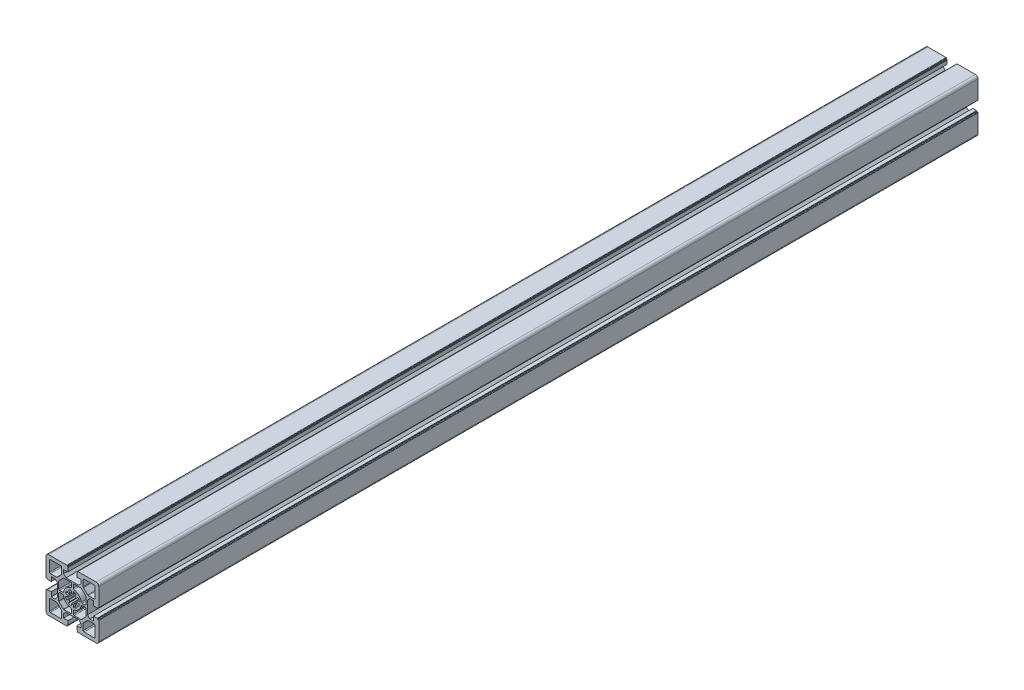
from build123d import *

# Parameters (mm, degrees)
BASE_EXTRUDE_DEPTH = 1000
ESCALA1_SCALE      = 0.5


with BuildPart() as part:
    # Sketch1 → Base-Extrude (new body)
    with BuildSketch(Plane.XY):
        with BuildLine():
            Line((7.24997588, 17.000014817), (-2.412e-05, 17.000014817))
            Line((-2.412e-05, 17.000014817), (-7.25002412, 17.000014817))
            Line((-7.25002412, 17.000014817), (-10.05002512, 19.800013819))
            Line((-10.05002512, 19.800013819), (-10.05002512, 24.000014819))
            Line((-10.05002512, 24.000014819), (-5.00002412, 24.000014819))
            Line((-5.00002412, 24.000014819), (-5.00002412, 28.20002069))
            ThreePointArc((-5.00002412, 28.20002069), (-5.08789044, 28.41214864), (-5.300018455, 28.500014819))
            Line((-5.300018455, 28.500014819), (-5.500021455, 28.500014819))
            ThreePointArc((-5.500021455, 28.500014819), (-5.712152769, 28.587882347), (-5.800020455, 28.800013596))
            Line((-5.800020455, 28.800013596), (-5.800020455, 29.500015192))
            ThreePointArc((-5.800020455, 29.500015192), (-5.946466955, 29.853568318), (-6.300020081, 30.000014817))
            Line((-6.300020081, 30.000014817), (-27.000022696, 30.000014817))
            ThreePointArc((-27.000022696, 30.000014817), (-29.121341455, 29.121335817), (-30.000020455, 27.000017059))
            Line((-30.000020455, 27.000017059), (-30.000020455, 6.300013444))
            ThreePointArc((-30.000020455, 6.300013444), (-29.853573955, 5.946460317), (-29.500020828, 5.800013817))
            Line((-29.500020828, 5.800013817), (-28.800019731, 5.800013817))
            ThreePointArc((-28.800019731, 5.800013817), (-28.587888208, 5.712146064), (-28.500020455, 5.500014542))
            Line((-28.500020455, 5.500014542), (-28.500020455, 5.300014093))
            ThreePointArc((-28.500020455, 5.300014093), (-28.412152701, 5.087882571), (-28.200021179, 5.000014817))
            Line((-28.200021179, 5.000014817), (-24.000020455, 5.000014817))
            Line((-24.000020455, 5.000014817), (-24.000020455, 10.050012866))
            Line((-24.000020455, 10.050012866), (-19.800019665, 10.050012866))
            Line((-19.800019665, 10.050012866), (-17.000019665, 7.250013866))
            Line((-17.000019665, 7.250013866), (-17.000019665, 4.3167e-05))
            Line((-17.000019665, 4.3167e-05), (-17.000019665, -7.249956831))
            Line((-17.000019665, -7.249956831), (-19.800019665, -10.049955831))
            Line((-19.800019665, -10.049955831), (-24.000020455, -10.049955831))
            Line((-24.000020455, -10.049955831), (-24.000020455, -4.999957783))
            Line((-24.000020455, -4.999957783), (-28.200021179, -4.999957783))
            ThreePointArc((-28.200021179, -4.999957783), (-28.412152701, -5.087825536), (-28.500020455, -5.299957058))
            Line((-28.500020455, -5.299957058), (-28.500020455, -5.499957507))
            ThreePointArc((-28.500020455, -5.499957507), (-28.587888208, -5.712089029), (-28.800019731, -5.799956783))
            Line((-28.800019731, -5.799956783), (-29.500020828, -5.799956783))
            ThreePointArc((-29.500020828, -5.799956783), (-29.853573955, -5.946403283), (-30.000020455, -6.299956409))
            Line((-30.000020455, -6.299956409), (-30.000020455, -26.999960024))
            ThreePointArc((-30.000020455, -26.999960024), (-29.121341455, -29.121278783), (-27.000022696, -29.999957783))
            Line((-27.000022696, -29.999957783), (-6.300020081, -29.999957783))
            ThreePointArc((-6.300020081, -29.999957783), (-5.946466955, -29.853511283), (-5.800020455, -29.499958157))
            Line((-5.800020455, -29.499958157), (-5.800020455, -28.799956561))
            ThreePointArc((-5.800020455, -28.799956561), (-5.712152769, -28.587825312), (-5.500021455, -28.499957784))
            Line((-5.500021455, -28.499957784), (-5.300018455, -28.499957784))
            ThreePointArc((-5.300018455, -28.499957784), (-5.08789044, -28.412091605), (-5.00002412, -28.199963655))
            Line((-5.00002412, -28.199963655), (-5.00002412, -23.999957784))
            Line((-5.00002412, -23.999957784), (-10.05002512, -23.999957784))
            Line((-10.05002512, -23.999957784), (-10.05002512, -19.799956784))
            Line((-10.05002512, -19.799956784), (-7.25002412, -16.999957783))
            Line((-7.25002412, -16.999957783), (-2.412e-05, -16.999957783))
            Line((-2.412e-05, -16.999957783), (7.24997588, -16.999957783))
            Line((7.24997588, -16.999957783), (10.04997688, -19.799956784))
            Line((10.04997688, -19.799956784), (10.04997688, -23.999957784))
            Line((10.04997688, -23.999957784), (4.99997588, -23.999957784))
            Line((4.99997588, -23.999957784), (4.99997588, -28.199963655))
            ThreePointArc((4.99997588, -28.199963655), (5.0878422, -28.412091605), (5.299970215, -28.499957784))
            Line((5.299970215, -28.499957784), (5.499973215, -28.499957784))
            ThreePointArc((5.499973215, -28.499957784), (5.71210453, -28.587825312), (5.799972216, -28.799956561))
            Line((5.799972216, -28.799956561), (5.799972216, -29.499958157))
            ThreePointArc((5.799972216, -29.499958157), (5.946418716, -29.853511283), (6.299971842, -29.999957783))
            Line((6.299971842, -29.999957783), (26.999974457, -29.999957783))
            ThreePointArc((26.999974457, -29.999957783), (29.121293215, -29.121278783), (29.999972215, -26.999960024))
            Line((29.999972215, -26.999960024), (29.999972215, -6.299956409))
            ThreePointArc((29.999972215, -6.299956409), (29.853525715, -5.946403283), (29.499972589, -5.799956783))
            Line((29.499972589, -5.799956783), (28.799971491, -5.799956783))
            ThreePointArc((28.799971491, -5.799956783), (28.587839969, -5.712089029), (28.499972215, -5.499957507))
            Line((28.499972215, -5.499957507), (28.499972215, -5.299957058))
            ThreePointArc((28.499972215, -5.299957058), (28.412104462, -5.087825536), (28.199972939, -4.999957783))
            Line((28.199972939, -4.999957783), (23.999972215, -4.999957783))
            Line((23.999972215, -4.999957783), (23.999972215, -10.049955831))
            Line((23.999972215, -10.049955831), (19.799971426, -10.049955831))
            Line((19.799971426, -10.049955831), (16.999971426, -7.249956831))
            Line((16.999971426, -7.249956831), (16.999971426, 4.3167e-05))
            Line((16.999971426, 4.3167e-05), (16.999971426, 7.250013866))
            Line((16.999971426, 7.250013866), (19.799971426, 10.050012866))
            Line((19.799971426, 10.050012866), (23.999972215, 10.050012866))
            Line((23.999972215, 10.050012866), (23.999972215, 5.000014817))
            Line((23.999972215, 5.000014817), (28.199972939, 5.000014817))
            ThreePointArc((28.199972939, 5.000014817), (28.412104462, 5.087882571), (28.499972215, 5.300014093))
            Line((28.499972215, 5.300014093), (28.499972215, 5.500014542))
            ThreePointArc((28.499972215, 5.500014542), (28.587839969, 5.712146064), (28.799971491, 5.800013817))
            Line((28.799971491, 5.800013817), (29.499972589, 5.800013817))
            ThreePointArc((29.499972589, 5.800013817), (29.853525715, 5.946460317), (29.999972215, 6.300013444))
            Line((29.999972215, 6.300013444), (29.999972215, 27.000017059))
            ThreePointArc((29.999972215, 27.000017059), (29.121293215, 29.121335817), (26.999974457, 30.000014817))
            Line((26.999974457, 30.000014817), (6.299971842, 30.000014817))
            ThreePointArc((6.299971842, 30.000014817), (5.946418716, 29.853568318), (5.799972216, 29.500015192))
            Line((5.799972216, 29.500015192), (5.799972216, 28.800013596))
            ThreePointArc((5.799972216, 28.800013596), (5.71210453, 28.587882347), (5.499973215, 28.500014819))
            Line((5.499973215, 28.500014819), (5.299970215, 28.500014819))
            ThreePointArc((5.299970215, 28.500014819), (5.0878422, 28.41214864), (4.99997588, 28.20002069))
            Line((4.99997588, 28.20002069), (4.99997588, 24.000014819))
            Line((4.99997588, 24.000014819), (10.04997688, 24.000014819))
            Line((10.04997688, 24.000014819), (10.04997688, 19.800013819))
            Line((10.04997688, 19.800013819), (7.24997588, 17.000014817))
        make_face()
        with BuildLine():
            Line((24.999970687, 12.300015508), (17.964182773, 12.300015508))
            ThreePointArc((17.964182773, 12.300015508), (17.581498992, 12.376136067), (17.257075378, 12.59290907))
            Line((17.257075378, 12.59290907), (12.592863552, 17.257122896))
            ThreePointArc((12.592863552, 17.257122896), (12.376090508, 17.581546796), (12.29996994, 17.964230842))
            Line((12.29996994, 17.964230842), (12.29996994, 25.000017255))
            ThreePointArc((12.29996994, 25.000017255), (12.59286294, 25.707123508), (13.299969193, 26.000016508))
            Line((13.299969193, 26.000016508), (24.999970687, 26.000016508))
            ThreePointArc((24.999970687, 26.000016508), (25.70707694, 25.707123508), (25.99996994, 25.000017255))
            Line((25.99996994, 25.000017255), (25.99996994, 13.300014761))
            ThreePointArc((25.99996994, 13.300014761), (25.70707694, 12.592908508), (24.999970687, 12.300015508))
        make_face(mode=Mode.SUBTRACT)
        with BuildLine():
            Line((-0.868254781, 4.924047323), (-1.389203942, 7.878492919))
            ThreePointArc((-1.389203942, 7.878492919), (-3.061491097, 7.391065963), (-4.588639176, 6.553242527))
            Line((-4.588639176, 6.553242527), (-2.867900032, 4.095774325))
            ThreePointArc((-2.867900032, 4.095774325), (-3.535545186, 3.535556326), (-4.095767305, 2.867914629))
            Line((-4.095767305, 2.867914629), (-6.553231573, 4.588649719))
            ThreePointArc((-6.553231573, 4.588649719), (-7.391053065, 3.061505388), (-7.878479822, 1.389222571))
            Line((-7.878479822, 1.389222571), (-4.924052211, 0.868276934))
            ThreePointArc((-4.924052211, 0.868276934), (-5.000015145, 2.8517e-05), (-4.924052211, -0.8682199))
            Line((-4.924052211, -0.8682199), (-7.878479822, -1.389165536))
            ThreePointArc((-7.878479822, -1.389165536), (-7.391053065, -3.061448353), (-6.553231573, -4.588592684))
            Line((-6.553231573, -4.588592684), (-4.095767305, -2.867857594))
            ThreePointArc((-4.095767305, -2.867857594), (-3.535545186, -3.535499291), (-2.867900032, -4.09571729))
            Line((-2.867900032, -4.09571729), (-4.588639176, -6.553185492))
            ThreePointArc((-4.588639176, -6.553185492), (-3.061491097, -7.391008929), (-1.389203942, -7.878435884))
            Line((-1.389203942, -7.878435884), (-0.868254781, -4.923990288))
            ThreePointArc((-0.868254781, -4.923990288), (-0.435797618, -4.980922606), (-2.412e-05, -4.999947433))
            ThreePointArc((-2.412e-05, -4.999947433), (0.435749379, -4.980922606), (0.868206541, -4.923990288))
            Line((0.868206541, -4.923990288), (1.389155702, -7.878435884))
            ThreePointArc((1.389155702, -7.878435884), (3.061442857, -7.391008929), (4.588590936, -6.553185492))
            Line((4.588590936, -6.553185492), (2.867851793, -4.09571729))
            ThreePointArc((2.867851793, -4.09571729), (3.535496947, -3.535499291), (4.095719065, -2.867857594))
            Line((4.095719065, -2.867857594), (6.553183334, -4.588592684))
            ThreePointArc((6.553183334, -4.588592684), (7.391004826, -3.061448353), (7.878431582, -1.389165536))
            Line((7.878431582, -1.389165536), (4.924003972, -0.8682199))
            ThreePointArc((4.924003972, -0.8682199), (4.999966905, 2.8517e-05), (4.924003972, 0.868276934))
            Line((4.924003972, 0.868276934), (7.878431582, 1.389222571))
            ThreePointArc((7.878431582, 1.389222571), (7.391004826, 3.061505388), (6.553183334, 4.588649719))
            Line((6.553183334, 4.588649719), (4.095719065, 2.867914629))
            ThreePointArc((4.095719065, 2.867914629), (3.535496947, 3.535556326), (2.867851793, 4.095774325))
            Line((2.867851793, 4.095774325), (4.588590936, 6.553242527))
            ThreePointArc((4.588590936, 6.553242527), (3.061442857, 7.391065963), (1.389155702, 7.878492919))
            Line((1.389155702, 7.878492919), (0.868206541, 4.924047323))
            ThreePointArc((0.868206541, 4.924047323), (0.435749379, 4.980979641), (-2.412e-05, 5.000004467))
            ThreePointArc((-2.412e-05, 5.000004467), (-0.435797618, 4.980979641), (-0.868254781, 4.924047323))
        make_face(mode=Mode.SUBTRACT)
        with BuildLine():
            Line((14.499970687, 1.000016508), (10.969128525, 1.000016508))
            ThreePointArc((10.969128525, 1.000016508), (10.328572063, 1.232105996), (9.985348997, 1.820643198))
            ThreePointArc((9.985348997, 1.820643198), (7.177103386, 7.177150109), (1.820595849, 9.985394525))
            ThreePointArc((1.820595849, 9.985394525), (1.232058499, 10.328617545), (0.99996894, 10.969174093))
            Line((0.99996894, 10.969174093), (0.99996894, 14.500017255))
            ThreePointArc((0.99996894, 14.500017255), (1.29286194, 15.207123508), (1.999968193, 15.500016508))
            Line((1.999968193, 15.500016508), (9.900222627, 15.500016508))
            ThreePointArc((9.900222627, 15.500016508), (10.091564812, 15.461956186), (10.253776891, 15.353569557))
            Line((10.253776891, 15.353569557), (15.35352292, 10.253824528))
            ThreePointArc((15.35352292, 10.253824528), (15.461909599, 10.091612425), (15.49996994, 9.900270195))
            Line((15.49996994, 9.900270195), (15.49996994, 2.000015761))
            ThreePointArc((15.49996994, 2.000015761), (15.20707694, 1.292909508), (14.499970687, 1.000016508))
        make_face(mode=Mode.SUBTRACT)
        with BuildLine():
            Line((-25.000018927, -12.299958473), (-17.964231013, -12.299958473))
            ThreePointArc((-17.964231013, -12.299958473), (-17.581547231, -12.376079032), (-17.257123618, -12.592852035))
            Line((-17.257123618, -12.592852035), (-12.592911792, -17.257065861))
            ThreePointArc((-12.592911792, -17.257065861), (-12.376138748, -17.581489761), (-12.30001818, -17.964173807))
            Line((-12.30001818, -17.964173807), (-12.30001818, -24.99996022))
            ThreePointArc((-12.30001818, -24.99996022), (-12.59291118, -25.707066473), (-13.300017432, -25.999959473))
            Line((-13.300017432, -25.999959473), (-25.000018927, -25.999959473))
            ThreePointArc((-25.000018927, -25.999959473), (-25.70712518, -25.707066473), (-26.00001818, -24.99996022))
            Line((-26.00001818, -24.99996022), (-26.00001818, -13.299957726))
            ThreePointArc((-26.00001818, -13.299957726), (-25.70712518, -12.592851473), (-25.000018927, -12.299958473))
        make_face(mode=Mode.SUBTRACT)
        with BuildLine():
            Line((-14.500018927, -0.999959473), (-10.969176764, -0.999959473))
            ThreePointArc((-10.969176764, -0.999959473), (-10.328620302, -1.232048961), (-9.985397236, -1.820586163))
            ThreePointArc((-9.985397236, -1.820586163), (-7.177151626, -7.177093074), (-1.820644088, -9.98533749))
            ThreePointArc((-1.820644088, -9.98533749), (-1.232106738, -10.32856051), (-1.00001718, -10.969117058))
            Line((-1.00001718, -10.969117058), (-1.00001718, -14.49996022))
            ThreePointArc((-1.00001718, -14.49996022), (-1.29291018, -15.207066473), (-2.000016432, -15.499959473))
            Line((-2.000016432, -15.499959473), (-9.900270866, -15.499959473))
            ThreePointArc((-9.900270866, -15.499959473), (-10.091613051, -15.461899151), (-10.25382513, -15.353512523))
            Line((-10.25382513, -15.353512523), (-15.353571159, -10.253767494))
            ThreePointArc((-15.353571159, -10.253767494), (-15.461957839, -10.091555391), (-15.50001818, -9.90021316))
            Line((-15.50001818, -9.90021316), (-15.50001818, -1.999958726))
            ThreePointArc((-15.50001818, -1.999958726), (-15.20712518, -1.292852473), (-14.500018927, -0.999959473))
        make_face(mode=Mode.SUBTRACT)
        with BuildLine():
            Line((0.99996894, -10.969117058), (0.99996894, -14.49996022))
            ThreePointArc((0.99996894, -14.49996022), (1.29286194, -15.207066473), (1.999968193, -15.499959473))
            Line((1.999968193, -15.499959473), (9.900222627, -15.499959473))
            ThreePointArc((9.900222627, -15.499959473), (10.091564812, -15.461899151), (10.253776891, -15.353512523))
            Line((10.253776891, -15.353512523), (15.35352292, -10.253767494))
            ThreePointArc((15.35352292, -10.253767494), (15.461909599, -10.091555391), (15.49996994, -9.90021316))
            Line((15.49996994, -9.90021316), (15.49996994, -1.999958726))
            ThreePointArc((15.49996994, -1.999958726), (15.20707694, -1.292852473), (14.499970687, -0.999959473))
            Line((14.499970687, -0.999959473), (10.969128525, -0.999959473))
            ThreePointArc((10.969128525, -0.999959473), (10.328572063, -1.232048961), (9.985348997, -1.820586163))
            ThreePointArc((9.985348997, -1.820586163), (7.177103386, -7.177093074), (1.820595849, -9.98533749))
            ThreePointArc((1.820595849, -9.98533749), (1.232058499, -10.32856051), (0.99996894, -10.969117058))
        make_face(mode=Mode.SUBTRACT)
        with BuildLine():
            Line((-1.00001718, 10.969174093), (-1.00001718, 14.500017255))
            ThreePointArc((-1.00001718, 14.500017255), (-1.29291018, 15.207123508), (-2.000016432, 15.500016508))
            Line((-2.000016432, 15.500016508), (-9.900270866, 15.500016508))
            ThreePointArc((-9.900270866, 15.500016508), (-10.091613051, 15.461956186), (-10.25382513, 15.353569557))
            Line((-10.25382513, 15.353569557), (-15.353571159, 10.253824528))
            ThreePointArc((-15.353571159, 10.253824528), (-15.461957839, 10.091612425), (-15.50001818, 9.900270195))
            Line((-15.50001818, 9.900270195), (-15.50001818, 2.000015761))
            ThreePointArc((-15.50001818, 2.000015761), (-15.20712518, 1.292909508), (-14.500018927, 1.000016508))
            Line((-14.500018927, 1.000016508), (-10.969176764, 1.000016508))
            ThreePointArc((-10.969176764, 1.000016508), (-10.328620302, 1.232105996), (-9.985397236, 1.820643198))
            ThreePointArc((-9.985397236, 1.820643198), (-7.177151626, 7.177150109), (-1.820644088, 9.985394525))
            ThreePointArc((-1.820644088, 9.985394525), (-1.232106738, 10.328617545), (-1.00001718, 10.969174093))
        make_face(mode=Mode.SUBTRACT)
        with BuildLine():
            Line((-26.00001818, 13.300014761), (-26.00001818, 25.000017255))
            ThreePointArc((-26.00001818, 25.000017255), (-25.70712518, 25.707123508), (-25.000018927, 26.000016508))
            Line((-25.000018927, 26.000016508), (-13.300017432, 26.000016508))
            ThreePointArc((-13.300017432, 26.000016508), (-12.59291118, 25.707123508), (-12.30001818, 25.000017255))
            Line((-12.30001818, 25.000017255), (-12.30001818, 17.964230842))
            ThreePointArc((-12.30001818, 17.964230842), (-12.376138748, 17.581546796), (-12.592911792, 17.257122896))
            Line((-12.592911792, 17.257122896), (-17.257123618, 12.59290907))
            ThreePointArc((-17.257123618, 12.59290907), (-17.581547231, 12.376136067), (-17.964231013, 12.300015508))
            Line((-17.964231013, 12.300015508), (-25.000018927, 12.300015508))
            ThreePointArc((-25.000018927, 12.300015508), (-25.70712518, 12.592908508), (-26.00001818, 13.300014761))
        make_face(mode=Mode.SUBTRACT)
        with BuildLine():
            Line((25.99996994, -13.299957726), (25.99996994, -24.99996022))
            ThreePointArc((25.99996994, -24.99996022), (25.70707694, -25.707066473), (24.999970687, -25.999959473))
            Line((24.999970687, -25.999959473), (13.299969193, -25.999959473))
            ThreePointArc((13.299969193, -25.999959473), (12.59286294, -25.707066473), (12.29996994, -24.99996022))
            Line((12.29996994, -24.99996022), (12.29996994, -17.964173807))
            ThreePointArc((12.29996994, -17.964173807), (12.376090508, -17.581489761), (12.592863552, -17.257065861))
            Line((12.592863552, -17.257065861), (17.257075378, -12.592852035))
            ThreePointArc((17.257075378, -12.592852035), (17.581498992, -12.376079032), (17.964182773, -12.299958473))
            Line((17.964182773, -12.299958473), (24.999970687, -12.299958473))
            ThreePointArc((24.999970687, -12.299958473), (25.70707694, -12.592851473), (25.99996994, -13.299957726))
        make_face(mode=Mode.SUBTRACT)
    extrude(amount=-BASE_EXTRUDE_DEPTH)


with BuildPart() as part_1:
    # Escala1: scaled about (0, 0, 0)
    add(part.part.scale(ESCALA1_SCALE))


solid = part_1.part
